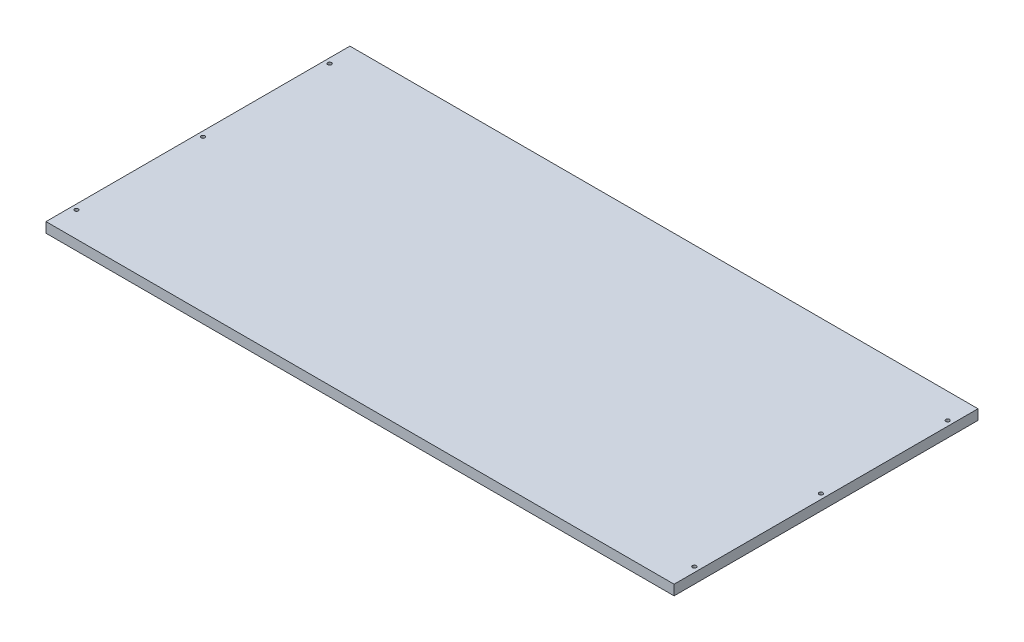
from build123d import *

# Parameters (mm, degrees)
SKETCH_1_W      = 372
SKETCH_1_H      = 180
SKETCH_1_R      = 1.1
EXTRUDE_1_DEPTH = 6


with BuildPart() as part:
    # Эскиз1 → Бобышка-Вытянуть1 (new body)
    with BuildSketch(Plane(origin=(0, 0, 0), x_dir=(1, 0, 0), z_dir=(0, 1, 0))):
        with Locations((-186, 90)):
            Rectangle(SKETCH_1_W, SKETCH_1_H)
        with Locations(Location((-369, 165, 0), (0, 0, 270))):
            Circle(SKETCH_1_R, mode=Mode.SUBTRACT)
        with Locations(Location((-369, 15, 0), (0, 0, 270))):
            Circle(SKETCH_1_R, mode=Mode.SUBTRACT)
        with Locations(Location((-3, 165, 0), (0, 0, 270))):
            Circle(SKETCH_1_R, mode=Mode.SUBTRACT)
        with Locations(Location((-3, 15, 0), (0, 0, 270))):
            Circle(SKETCH_1_R, mode=Mode.SUBTRACT)
        with Locations(Location((-369, 90, 0), (0, 0, 270))):
            Circle(SKETCH_1_R, mode=Mode.SUBTRACT)
        with Locations(Location((-3, 90, 0), (0, 0, 270))):
            Circle(SKETCH_1_R, mode=Mode.SUBTRACT)
    extrude(amount=EXTRUDE_1_DEPTH)


solid = part.part
